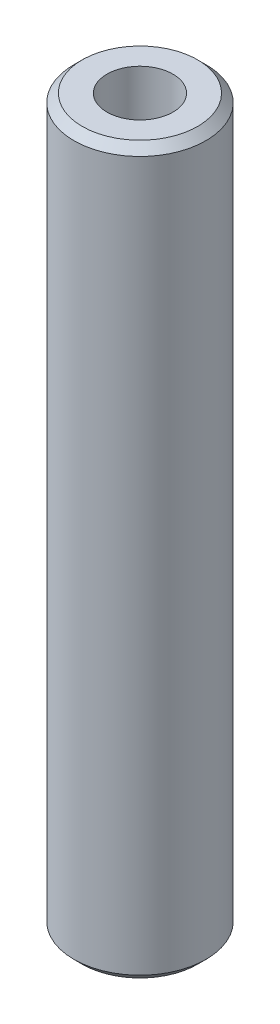
from build123d import *

# Parameters (mm, degrees)
SKETCH1_R           = 4
SKETCH1_R_2         = 2
BOSS_EXTRUDE1_DEPTH = 44
CHAMFER1_SIZE       = 0.5


with BuildPart() as part:
    # Sketch1 → Boss-Extrude1 (new body)
    with BuildSketch(Plane(origin=(0, 0, 0), x_dir=(1, 0, 0), z_dir=(0, 1, 0))):
        with Locations(Location((0, 0, 0), (0, 0, 270))):
            Circle(SKETCH1_R)
        with Locations(Location((0, 0, 0), (0, 0, 270))):
            Circle(SKETCH1_R_2, mode=Mode.SUBTRACT)
    extrude(amount=BOSS_EXTRUDE1_DEPTH)

    # Chamfer1
    chamfer1_edges = [part.edges().sort_by_distance(p)[0] for p in [
        (0, 0, -4),
        (0, 44, -4),
    ]]
    chamfer(chamfer1_edges, length=CHAMFER1_SIZE)


solid = part.part
